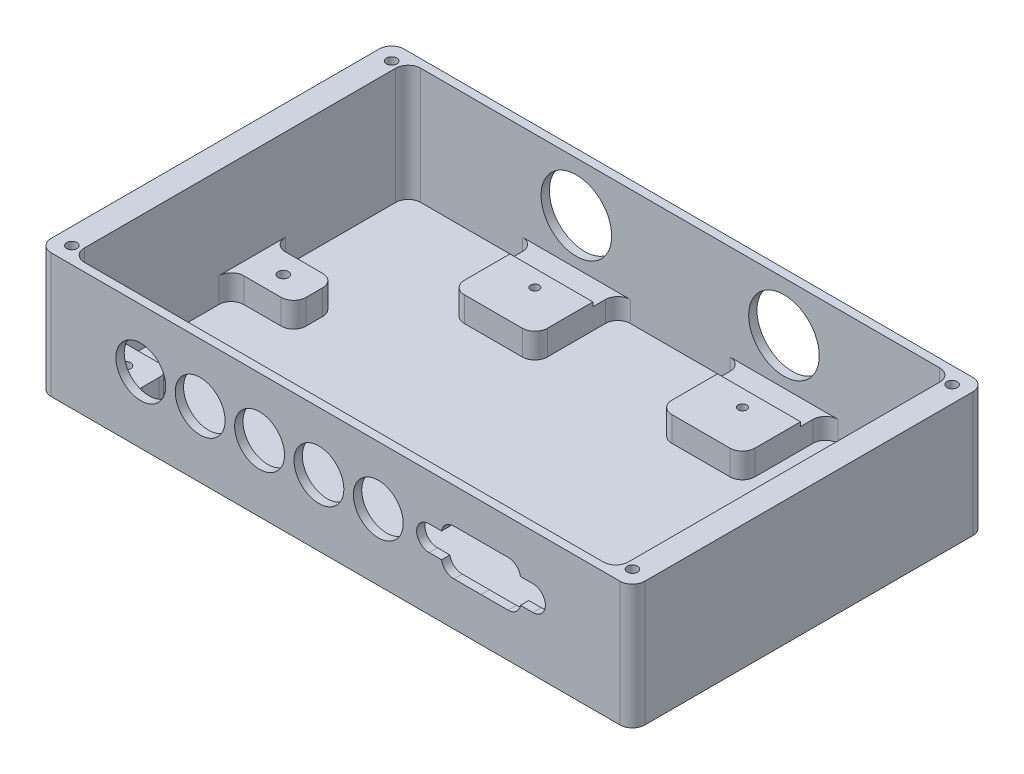
from build123d import *

# Parameters (mm, degrees)
SKIZZE1_W                       = 135
SKIZZE1_H                       = 85
AUFSATZ_LINEAR_AUSTRAGEN1_DEPTH = 30
SCHALE1_T                       = -2
SKIZZE2_R                       = 6
SCHNITT_LINEAR_AUSTRAGEN1_DEPTH = 30
SCHNITT_LINEAR_AUSTRAGEN2_DEPTH = 10
VERRUNDUNG1_R                   = 3
AUFSATZ_LINEAR_AUSTRAGEN2_DEPTH = 6
VERRUNDUNG2_R                   = 3
SKIZZE5_W                       = 15
SKIZZE5_H                       = 10
AUFSATZ_LINEAR_AUSTRAGEN3_DEPTH = 6
VERRUNDUNG3_R                   = 3
SKIZZE6_R                       = 8.5
SCHNITT_LINEAR_AUSTRAGEN3_DEPTH = 5
SKIZZE7_W                       = 20
SKIZZE7_H                       = 20
AUFSATZ_LINEAR_AUSTRAGEN4_DEPTH = 6
VERRUNDUNG4_R                   = 3
M3_GEWINDEBOHRUNG1_D            = 2.5
M3_GEWINDEBOHRUNG1_DEPTH        = 8.5
M3_GEWINDEBOHRUNG1_TIP          = 0.751075774
M2_5_GEWINDEBOHRUNG1_D          = 2.05
M2_5_GEWINDEBOHRUNG1_DEPTH      = 7.25
M2_5_GEWINDEBOHRUNG1_TIP        = 0.615882135
SKIZZE12_W                      = 85
SKIZZE12_H                      = 6
SCHNITT_LINEAR_AUSTRAGEN4_DEPTH = 1
SKIZZE13_R                      = 3.2
SCHNITT_LINEAR_AUSTRAGEN5_DEPTH = 10
AUFSATZ_LINEAR_START            = -30
AUFSATZ_LINEAR_AUSTRAGEN5_DEPTH = 30
M3_GEWINDEBOHRUNG2_D            = 2.5
M3_GEWINDEBOHRUNG2_DEPTH        = 8.5
M3_GEWINDEBOHRUNG2_TIP          = 0.751075774
VERRUNDUNG5_R                   = 3


with BuildPart() as part:
    # Skizze1 → Aufsatz-Linear austragen1 (new body)
    with BuildSketch(Plane(origin=(0, 0, 0), x_dir=(1, 0, 0), z_dir=(0, 1, 0))):
        with Locations((67.5, 42.5)):
            Rectangle(SKIZZE1_W, SKIZZE1_H)
    extrude(amount=AUFSATZ_LINEAR_AUSTRAGEN1_DEPTH)

    # Schale1
    schale1_openings = [part.faces().sort_by_distance(p)[0] for p in [
        (67.5, 30, -42.5),
    ]]
    offset(amount=SCHALE1_T, openings=schale1_openings, kind=Kind.INTERSECTION)

    # Skizze2 → Schnitt-Linear austragen1 (cut)
    with BuildSketch(Plane.XY):
        with Locations((20.6, 15.94)):
            Circle(SKIZZE2_R)
        with Locations((34.9, 15.94)):
            Circle(SKIZZE2_R)
        with Locations((49.2, 15.94)):
            Circle(SKIZZE2_R)
        with Locations((63.5, 15.94)):
            Circle(SKIZZE2_R)
        with Locations((77.8, 15.94)):
            Circle(SKIZZE2_R)
    extrude(amount=-SCHNITT_LINEAR_AUSTRAGEN1_DEPTH, mode=Mode.SUBTRACT)

    # Skizze3 → Schnitt-Linear austragen2 (cut)
    with BuildSketch(Plane.XY):
        with BuildLine():
            ThreePointArc((109.082181292, 21.48963825), (111.018633773, 20.780819017), (112.040082938, 18.989474685))
            Line((112.040082938, 18.989474685), (115.04016588, 18.989308791))
            ThreePointArc((115.04016588, 18.989308791), (118.039999986, 15.989142906), (115.039834101, 12.9893088))
            Line((115.039834101, 12.9893088), (112.03975116, 12.989474694))
            ThreePointArc((112.03975116, 12.989474694), (111.018103892, 11.198243337), (109.081573032, 10.489638266))
            Line((109.081573032, 10.489638266), (102.54015207, 10.49))
            Line((102.54015207, 10.49), (95.998122837, 10.49))
            ThreePointArc((95.998122837, 10.49), (94.061631164, 11.198712153), (93.040082946, 12.99))
            Line((93.040082946, 12.99), (90.04, 12.99))
            ThreePointArc((90.04, 12.99), (87.04, 15.99), (90.04, 18.99))
            Line((90.04, 18.99), (93.040082946, 18.99))
            ThreePointArc((93.040082946, 18.99), (94.061631164, 20.781287847), (95.998122837, 21.49))
            Line((95.998122837, 21.49), (102.54015207, 21.49))
            Line((102.54015207, 21.49), (109.082181292, 21.48963825))
        make_face()
    extrude(amount=-SCHNITT_LINEAR_AUSTRAGEN2_DEPTH, mode=Mode.SUBTRACT)

    # Verrundung1
    verrundung1_edges = [part.edges().sort_by_distance(p)[0] for p in [
        (2, 16, -83),
        (2, 16, -2),
        (133, 16, -2),
        (133, 16, -83),
        (0, 15, -85),
        (135, 15, -85),
        (135, 15, 0),
        (0, 15, 0),
    ]]
    fillet(verrundung1_edges, radius=VERRUNDUNG1_R)

    # Skizze4 → Aufsatz-Linear austragen2 (add)
    with BuildSketch(Plane(origin=(0, 2, 0), x_dir=(1, 0, 0), z_dir=(0, 1, 0))):
        with BuildLine():
            Line((13, 12), (2, 12))
            Line((2, 12), (2, 5))
            ThreePointArc((2, 5), (2.878679656, 2.878679656), (5, 2))
            Line((5, 2), (16, 2))
            Line((16, 2), (16, 9))
            ThreePointArc((16, 9), (15.121320344, 11.121320344), (13, 12))
        make_face()
        with BuildLine():
            Line((119, 9), (119, 2))
            Line((119, 2), (130, 2))
            ThreePointArc((130, 2), (132.121320344, 2.878679656), (133, 5))
            Line((133, 5), (133, 12))
            Line((133, 12), (122, 12))
            ThreePointArc((122, 12), (119.878679656, 11.121320344), (119, 9))
        make_face()
    extrude(amount=AUFSATZ_LINEAR_AUSTRAGEN2_DEPTH)

    # Verrundung2
    verrundung2_edges = [part.edges().sort_by_distance(p)[0] for p in [
        (2, 5, -12),
        (16, 5, -2),
        (133, 5, -12),
        (119, 5, -2),
    ]]
    fillet(verrundung2_edges, radius=VERRUNDUNG2_R)

    # Skizze5 → Aufsatz-Linear austragen3 (add)
    with BuildSketch(Plane(origin=(0, 2, 0), x_dir=(1, 0, 0), z_dir=(0, 1, 0))):
        with Locations((9.5, 45.4)):
            Rectangle(SKIZZE5_W, SKIZZE5_H)
        with Locations((125.5, 45.4)):
            Rectangle(SKIZZE5_W, SKIZZE5_H)
    extrude(amount=AUFSATZ_LINEAR_AUSTRAGEN3_DEPTH)

    # Verrundung3
    verrundung3_edges = [part.edges().sort_by_distance(p)[0] for p in [
        (2, 5, -50.4),
        (2, 5, -40.4),
        (17, 5, -40.4),
        (17, 5, -50.4),
        (133, 5, -50.4),
        (118, 5, -50.4),
        (118, 5, -40.4),
        (133, 5, -40.4),
    ]]
    fillet(verrundung3_edges, radius=VERRUNDUNG3_R)

    # Skizze6 → Schnitt-Linear austragen3 (cut)
    with BuildSketch(Plane(origin=(0, 0, -85), x_dir=(-1, 0, 0), z_dir=(0, 0, -1))):
        with Locations((-92.5, 18)):
            Circle(SKIZZE6_R)
        with Locations(Location((-42.5, 18, 0), (0, 0, 180))):
            Circle(SKIZZE6_R)
    extrude(amount=-SCHNITT_LINEAR_AUSTRAGEN3_DEPTH, mode=Mode.SUBTRACT)

    # Skizze7 → Aufsatz-Linear austragen4 (add)
    with BuildSketch(Plane(origin=(0, 2, 0), x_dir=(1, 0, 0), z_dir=(0, 1, 0))):
        with Locations((42.5, 73)):
            Rectangle(SKIZZE7_W, SKIZZE7_H)
        with Locations((92.5, 73)):
            Rectangle(SKIZZE7_W, SKIZZE7_H)
    extrude(amount=AUFSATZ_LINEAR_AUSTRAGEN4_DEPTH)

    # Verrundung4
    verrundung4_edges = [part.edges().sort_by_distance(p)[0] for p in [
        (32.5, 5, -63),
        (52.5, 5, -63),
        (52.5, 5, -83),
        (32.5, 5, -83),
        (82.5, 5, -63),
        (102.5, 5, -63),
        (102.5, 5, -83),
        (82.5, 5, -83),
    ]]
    fillet(verrundung4_edges, radius=VERRUNDUNG4_R)

    # M3 Gewindebohrung1
    with Locations(Plane(origin=(0, 8, 0), x_dir=(1, 0, 0), z_dir=(0, 1, 0))):
        with Locations((125.5, 7.4), (9.5, 45.4), (125.5, 45.4), (9.5, 7.4)):
            Hole(M3_GEWINDEBOHRUNG1_D / 2, depth=M3_GEWINDEBOHRUNG1_DEPTH)
            with Locations((0, 0, -(M3_GEWINDEBOHRUNG1_DEPTH + M3_GEWINDEBOHRUNG1_TIP / 2))):  # 118° drill point
                Cone(0, M3_GEWINDEBOHRUNG1_D / 2, M3_GEWINDEBOHRUNG1_TIP, mode=Mode.SUBTRACT)

    # M2.5 Gewindebohrung1
    with Locations(Plane(origin=(0, 8, 0), x_dir=(1, 0, 0), z_dir=(0, 1, 0))):
        with Locations((42.5, 73), (92.5, 73)):
            Hole(M2_5_GEWINDEBOHRUNG1_D / 2, depth=M2_5_GEWINDEBOHRUNG1_DEPTH)
            with Locations((0, 0, -(M2_5_GEWINDEBOHRUNG1_DEPTH + M2_5_GEWINDEBOHRUNG1_TIP / 2))):  # 118° drill point
                Cone(0, M2_5_GEWINDEBOHRUNG1_D / 2, M2_5_GEWINDEBOHRUNG1_TIP, mode=Mode.SUBTRACT)

    # Skizze12 → Schnitt-Linear austragen4 (cut)
    with BuildSketch(Plane(origin=(0, 8, 0), x_dir=(1, 0, 0), z_dir=(0, 1, 0))):
        with Locations((66.348936769, 80)):
            Rectangle(SKIZZE12_W, SKIZZE12_H)
    extrude(amount=-SCHNITT_LINEAR_AUSTRAGEN4_DEPTH, mode=Mode.SUBTRACT)

    # Skizze13 → Schnitt-Linear austragen5 (cut)
    with BuildSketch(Plane(origin=(0, 2, 0), x_dir=(1, 0, 0), z_dir=(0, 1, 0))):
        with Locations(Location((97.5, 25, 0), (0, 0, 270))):
            Circle(SKIZZE13_R)
        with Locations(Location((37.5, 25, 0), (0, 0, 90))):
            Circle(SKIZZE13_R)
    extrude(amount=-SCHNITT_LINEAR_AUSTRAGEN5_DEPTH, mode=Mode.SUBTRACT)

    # Skizze14 → Aufsatz-Linear austragen5 (add)
    with BuildSketch(Plane.XZ.offset(AUFSATZ_LINEAR_START)):
        with BuildLine():
            Line((0, -85), (-4, -85))
            Line((-4, -85), (-4, 0))
            Line((-4, 0), (0, 0))
            Line((0, 0), (3, 0))
            ThreePointArc((3, 0), (0.878679656, -0.878679656), (0, -3))
            Line((0, -3), (0, -82))
            ThreePointArc((0, -82), (0.878679656, -84.121320344), (3, -85))
            Line((3, -85), (0, -85))
        make_face()
        with BuildLine():
            Line((135, 0), (139, 0))
            Line((139, 0), (139, -85))
            Line((139, -85), (135, -85))
            Line((135, -85), (132, -85))
            ThreePointArc((132, -85), (134.121320344, -84.121320344), (135, -82))
            Line((135, -82), (135, -3))
            ThreePointArc((135, -3), (134.121320344, -0.878679656), (132, 0))
            Line((132, 0), (135, 0))
        make_face()
    extrude(amount=AUFSATZ_LINEAR_AUSTRAGEN5_DEPTH)

    # M3 Gewindebohrung2
    with Locations(Plane(origin=(76.74477579, 30, -27.1140539), x_dir=(1, 0, 0), z_dir=(0, 1, 0))):
        with Locations((-76.74477579, -23.1140539), (58.25522421, 53.8859461), (-76.74477579, 53.8859461), (58.25522421, -23.1140539)):
            Hole(M3_GEWINDEBOHRUNG2_D / 2, depth=M3_GEWINDEBOHRUNG2_DEPTH)
            with Locations((0, 0, -(M3_GEWINDEBOHRUNG2_DEPTH + M3_GEWINDEBOHRUNG2_TIP / 2))):  # 118° drill point
                Cone(0, M3_GEWINDEBOHRUNG2_D / 2, M3_GEWINDEBOHRUNG2_TIP, mode=Mode.SUBTRACT)

    # Verrundung5
    verrundung5_edges = [part.edges().sort_by_distance(p)[0] for p in [
        (-4, 15, -85),
        (-4, 15, 0),
        (139, 15, 0),
        (139, 15, -85),
    ]]
    fillet(verrundung5_edges, radius=VERRUNDUNG5_R)


solid = part.part
